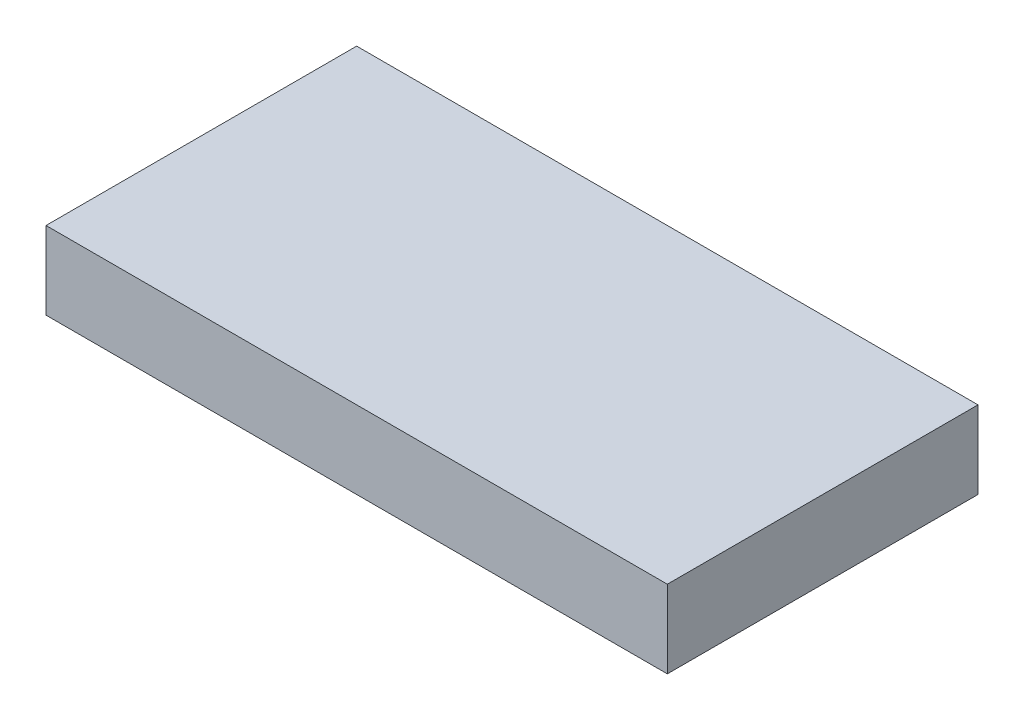
from build123d import *

# Parameters (mm, degrees)
SKETCH1_W           = 508
SKETCH1_H           = 254
BOSS_EXTRUDE1_DEPTH = 63.5


with BuildPart() as part:
    # Sketch1 → Boss-Extrude1 (new body)
    with BuildSketch(Plane(origin=(0, 0, 0), x_dir=(1, 0, 0), z_dir=(0, 1, 0))):
        with Locations((254, 127)):
            Rectangle(SKETCH1_W, SKETCH1_H)
    extrude(amount=BOSS_EXTRUDE1_DEPTH)


solid = part.part
